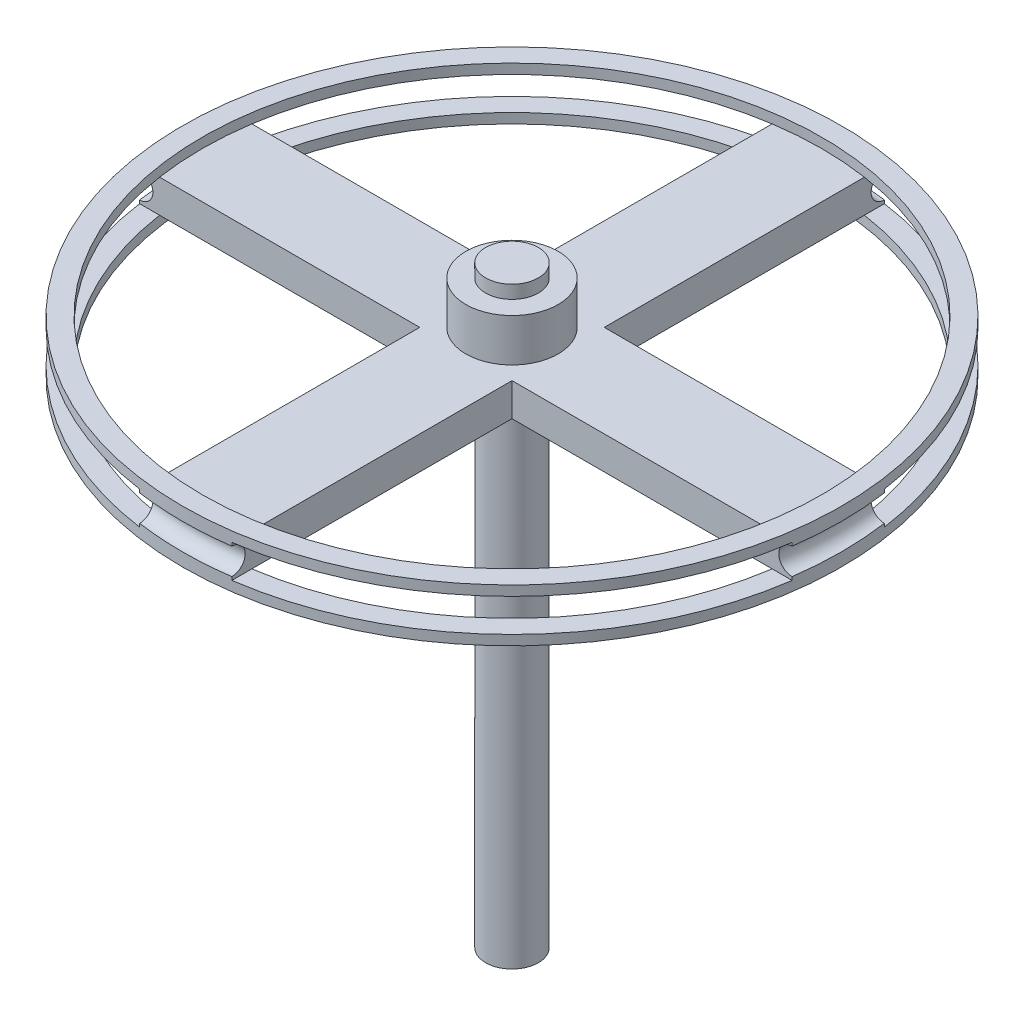
from build123d import *

# Parameters (mm, degrees)
CUT_EXTRUDE1_REACH       = 144.018
BOSS_EXTRUDE1_DEPTH      = 150
BOSS_EXTRUDE1_DEPTH_BACK = 30
SKETCH3_R                = 8


with BuildPart() as part:
    # Sketch1 → Revolve2 (revolve)
    with BuildSketch(Plane.XY, mode=Mode.PRIVATE) as revolve2_sk:
        with BuildLine():
            Line((8, 8), (8, -8))
            Line((8, -8), (14, -8))
            Line((14, -8), (14, -5))
            Line((14, -5), (94, -5))
            Line((94, -5), (94, -8))
            Line((94, -8), (100, -8))
            Line((100, -8), (100, -4))
            ThreePointArc((100, -4), (96, 0), (100, 4))
            Line((100, 4), (100, 8))
            Line((100, 8), (94, 8))
            Line((94, 8), (94, 5))
            Line((94, 5), (14, 5))
            Line((14, 5), (14, 8))
            Line((14, 8), (14, 18))
            Line((14, 18), (8, 18))
            Line((8, 18), (8, 8))
        make_face()
    revolve(revolve2_sk.sketch.rotate(Axis((0, 60.317614973, 0), (0, -1, 0)), 90), axis=Axis((0, 60.317614973, 0), (0, -1, 0)))

    # Cut-Extrude1: up to this face of the body (flat: up to its plane)
    cut_extrude1_end = Plane(part.part.faces().sort_by_distance((0, -5, -16.658721497))[0])
    # Sketch2 → Cut-Extrude1 (cut, up to the picked face)
    with BuildSketch(Plane(origin=(0, 5, 0), x_dir=(1, 0, 0), z_dir=(0, 1, 0)), mode=Mode.PRIVATE) as cut_extrude1_sk1:
        with BuildLine():
            Line((14, 14), (14, 173.435867109))
            ThreePointArc((14, 173.435867109), (123.036579926, 123.036579926), (173.435867109, 14))
            Line((173.435867109, 14), (14, 14))
        make_face()
    cut_extrude1_tool1 = split(extrude(cut_extrude1_sk1.sketch, amount=-CUT_EXTRUDE1_REACH, mode=Mode.PRIVATE), bisect_by=cut_extrude1_end, keep=Keep.BOTH, mode=Mode.PRIVATE)
    # Sketch2 → Cut-Extrude1 (cut, up to the picked face)
    with BuildSketch(Plane(origin=(0, 5, 0), x_dir=(1, 0, 0), z_dir=(0, 1, 0)), mode=Mode.PRIVATE) as cut_extrude1_sk2:
        with BuildLine():
            Line((-173.435867109, -14), (-14, -14))
            Line((-14, -14), (-14, -173.435867109))
            ThreePointArc((-14, -173.435867109), (-123.036579926, -123.036579926), (-173.435867109, -14))
        make_face()
    cut_extrude1_tool2 = split(extrude(cut_extrude1_sk2.sketch, amount=-CUT_EXTRUDE1_REACH, mode=Mode.PRIVATE), bisect_by=cut_extrude1_end, keep=Keep.BOTH, mode=Mode.PRIVATE)
    # Sketch2 → Cut-Extrude1 (cut, up to the picked face)
    with BuildSketch(Plane(origin=(0, 5, 0), x_dir=(1, 0, 0), z_dir=(0, 1, 0)), mode=Mode.PRIVATE) as cut_extrude1_sk3:
        with BuildLine():
            Line((-14, 14), (-14, 173.435867109))
            ThreePointArc((-14, 173.435867109), (-123.036579926, 123.036579926), (-173.435867109, 14))
            Line((-173.435867109, 14), (-14, 14))
        make_face()
    cut_extrude1_tool3 = split(extrude(cut_extrude1_sk3.sketch, amount=-CUT_EXTRUDE1_REACH, mode=Mode.PRIVATE), bisect_by=cut_extrude1_end, keep=Keep.BOTH, mode=Mode.PRIVATE)
    # Sketch2 → Cut-Extrude1 (cut, up to the picked face)
    with BuildSketch(Plane(origin=(0, 5, 0), x_dir=(1, 0, 0), z_dir=(0, 1, 0)), mode=Mode.PRIVATE) as cut_extrude1_sk4:
        with BuildLine():
            Line((14, -14), (173.435867109, -14))
            ThreePointArc((173.435867109, -14), (123.036579926, -123.036579926), (14, -173.435867109))
            Line((14, -173.435867109), (14, -14))
        make_face()
    cut_extrude1_tool4 = split(extrude(cut_extrude1_sk4.sketch, amount=-CUT_EXTRUDE1_REACH, mode=Mode.PRIVATE), bisect_by=cut_extrude1_end, keep=Keep.BOTH, mode=Mode.PRIVATE)
    add(cut_extrude1_tool1.solids().sort_by(Axis((80.012708, 5, -80.012708), (0, -1, 0)))[0], mode=Mode.SUBTRACT)
    add(cut_extrude1_tool2.solids().sort_by(Axis((-80.012708, 5, 80.012708), (0, -1, 0)))[0], mode=Mode.SUBTRACT)
    add(cut_extrude1_tool3.solids().sort_by(Axis((-80.012708, 5, -80.012708), (0, -1, 0)))[0], mode=Mode.SUBTRACT)
    add(cut_extrude1_tool4.solids().sort_by(Axis((80.012708, 5, 80.012708), (0, -1, 0)))[0], mode=Mode.SUBTRACT)

    # Sketch3 → Boss-Extrude1 (add, two sides: drawn at the far end of the back side and taken through both)
    with BuildSketch(Plane.XZ.offset(8).offset(-BOSS_EXTRUDE1_DEPTH_BACK)):
        with Locations(Location((0, 0, 0), (0, 0, 270))):
            Circle(SKETCH3_R)
    extrude(amount=BOSS_EXTRUDE1_DEPTH + BOSS_EXTRUDE1_DEPTH_BACK)


solid = part.part
